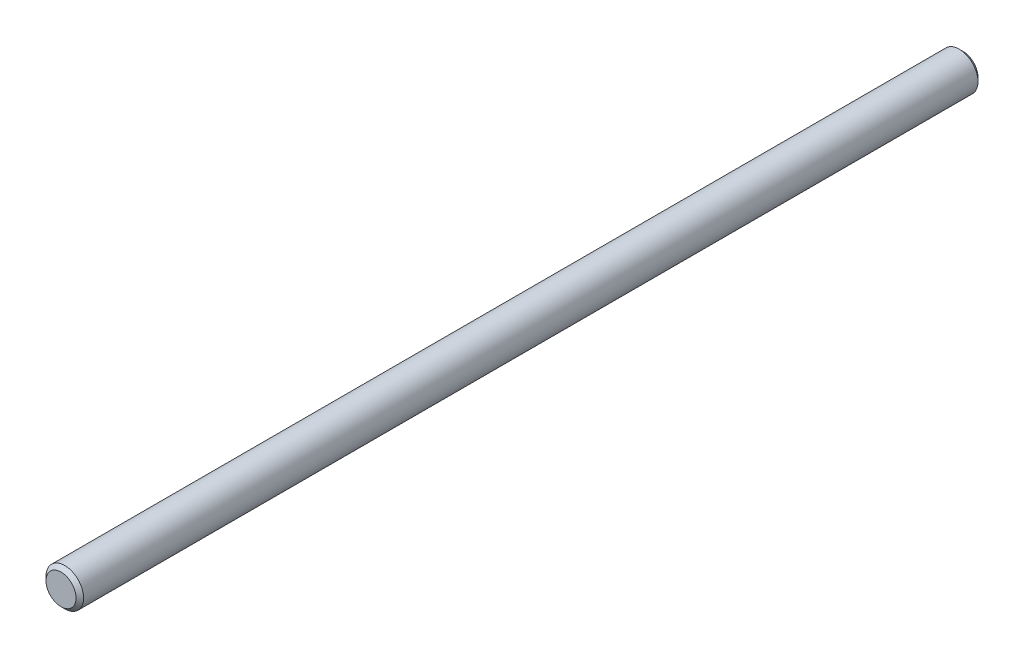
from build123d import *

# Parameters (mm, degrees)
SKETCH3_R           = 1.5875
BOSS_EXTRUDE1_DEPTH = 38.1
CHAMFER1_SIZE       = 0.3175


with BuildPart() as part:
    # Sketch3 → Boss-Extrude1 (new, symmetric)
    with BuildSketch(Plane.XY):
        with Locations(Location((0, 0, 0), (0, 0, 180))):
            Circle(SKETCH3_R)
    extrude(amount=BOSS_EXTRUDE1_DEPTH, both=True)

    # Chamfer1
    chamfer1_edges = [part.edges().sort_by_distance(p)[0] for p in [
        (1.5875, 0, -38.1),
        (1.5875, 0, 38.1),
    ]]
    chamfer(chamfer1_edges, length=CHAMFER1_SIZE)


solid = part.part
